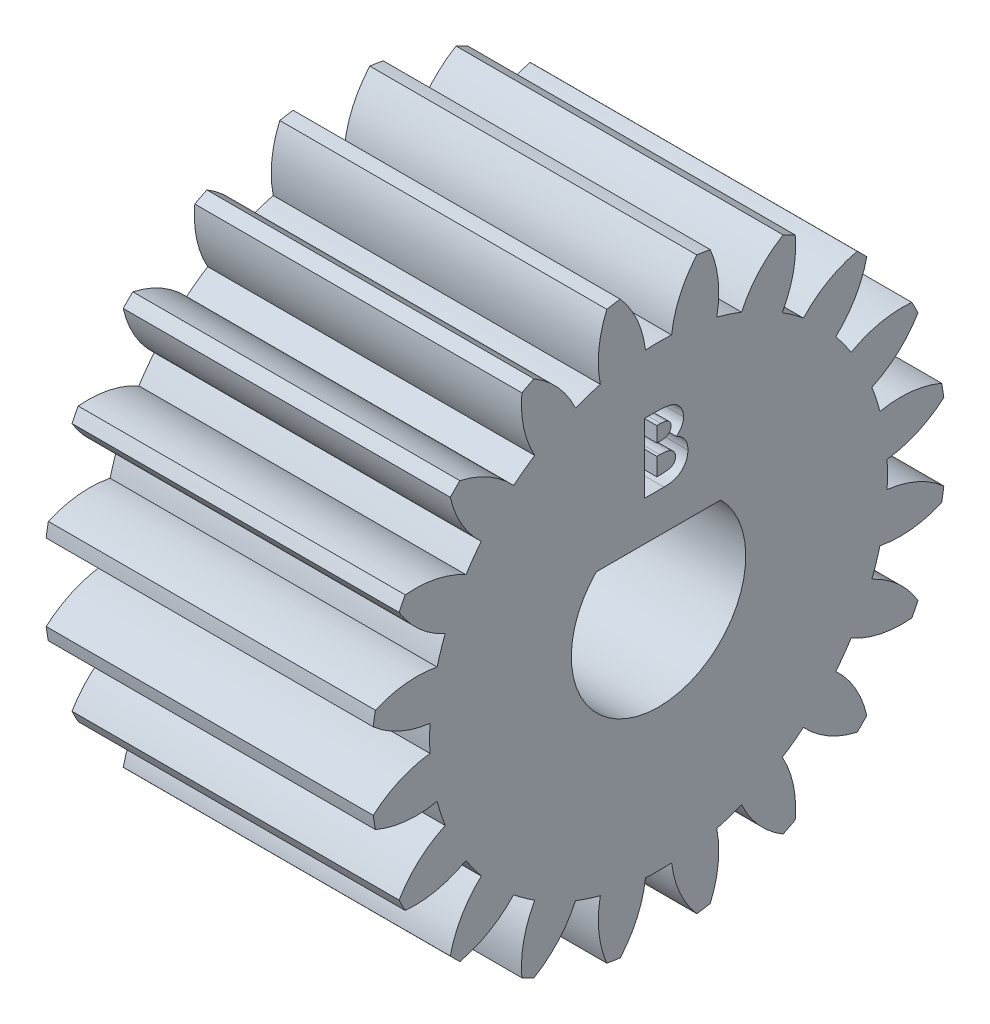
from build123d import *

# Parameters (mm, degrees)
BASPROSKE_W         = 15
BASPROSKE_H         = 13.2
TOOTHCUT_DEPTH      = 24.947442452
TEETHCUTS_COUNT     = 20
TEETHCUTS_ANGLE     = 342
BORSKE_R            = 4
BORE_DEPTH          = 50.0000508
BOSS_EXTRUDE1_START = -15
BOSS_EXTRUDE1_DEPTH = 15
SKETCH2_R           = 7.2
SKETCH2_R_2         = 6
CUT_EXTRUDE1_DEPTH  = 0.5
CUT_EXTRUDE2_DEPTH  = 2


with BuildPart() as part:
    # BasProSke → Base-Revolve (revolve)
    with BuildSketch(Plane(origin=(0, 0, 0), x_dir=(1, 0, 0), z_dir=(0, 1, 0)), mode=Mode.PRIVATE) as base_revolve_sk:
        with Locations((7.5, 6.6)):
            Rectangle(BASPROSKE_W, BASPROSKE_H)
    revolve(base_revolve_sk.sketch.rotate(Axis((-10, 0, 0), (1, 0, 0)), 180), axis=Axis((-10, 0, 0), (1, 0, 0)))

    # TooCutSke → ToothCut (cut, through all)
    with BuildSketch(Plane(origin=(0, 0, 0), x_dir=(0, 0, -1), z_dir=(1, 0, 0))):
        with BuildLine():
            ThreePointArc((0.599012827, 10.48189795), (0, 10.499), (-0.599012827, 10.48189795))
            ThreePointArc((-0.599012827, 10.48189795), (-0.986906343, 11.883983562), (-1.777012823, 13.105473306))
            ThreePointArc((-1.777012823, 13.105473306), (0, 13.2254), (1.777012823, 13.105473306))
            ThreePointArc((1.777012823, 13.105473306), (0.986906343, 11.883983562), (0.599012827, 10.48189795))
        make_face()
    toothcut = extrude(amount=TOOTHCUT_DEPTH, mode=Mode.SUBTRACT)

    # TeethCuts: ToothCut ×20 about axis
    teethcuts_axis = Axis((-10, 0, 0), (1, 0, 0))
    for i in range(1, TEETHCUTS_COUNT):
        add(toothcut.rotate(teethcuts_axis, i * TEETHCUTS_ANGLE / (TEETHCUTS_COUNT - 1)), mode=Mode.SUBTRACT)

    # BorSke → Bore (cut, symmetric)
    with BuildSketch(Plane(origin=(0, 0, 0), x_dir=(0, 0, -1), z_dir=(1, 0, 0))):
        with Locations(Location((0, 0, 0), (0, 0, 180))):
            Circle(BORSKE_R)
    extrude(amount=BORE_DEPTH, both=True, mode=Mode.SUBTRACT)

    # Sketch1 → Boss-Extrude1 (add)
    with BuildSketch(Plane.ZY.offset(BOSS_EXTRUDE1_START)):
        with BuildLine():
            Line((2.856571371, 2.8), (-2.856571371, 2.8))
            ThreePointArc((-2.856571371, 2.8), (0, 4), (2.856571371, 2.8))
        make_face()
    extrude(amount=BOSS_EXTRUDE1_DEPTH)

    # Sketch2 → Cut-Extrude1 (cut)
    with BuildSketch(Plane.ZY):
        Circle(SKETCH2_R)
        Circle(SKETCH2_R_2, mode=Mode.SUBTRACT)
    extrude(amount=-CUT_EXTRUDE1_DEPTH, mode=Mode.SUBTRACT)

    # Sketch3 → Cut-Extrude2 (cut)
    with BuildSketch(Plane(origin=(15, 0, 0), x_dir=(0, 0, -1), z_dir=(1, 0, 0))):
        with BuildLine():
            Line((-0.646125473, 4.61452133), (-0.646125473, 7.78952133))
            Line((-0.646125473, 7.78952133), (-0.137311371, 7.78952133))
            add(Edge.make_bspline(
                [(-0.137311371, 7.78952133), (-0.101691202, 7.789525396), (-0.032766851, 7.789533262), (0.066673, 7.786041261), (0.158895064, 7.781523966), (0.243605854, 7.776470164), (0.320949555, 7.767761453), (0.390808551, 7.758583423), (0.453322423, 7.747515284), (0.491971353, 7.737586821), (0.510154575, 7.732915762)],
                knots=[0, 0, 0, 0, 1.311965854, 2.538629056, 3.664479157, 4.713267157, 5.663616078, 6.530575999, 7.308677837, 8, 8, 8, 8], degree=3))
            add(Edge.make_bspline(
                [(0.510154575, 7.732915762), (0.534030991, 7.726327149), (0.580884184, 7.713398177), (0.647992908, 7.687287558), (0.711654894, 7.658263754), (0.771792412, 7.625153021), (0.828036194, 7.587555622), (0.880172495, 7.545173171), (0.929325765, 7.499706897), (0.973750685, 7.44988967), (1.013903492, 7.397248542), (1.048789083, 7.341797305), (1.07910019, 7.284383846), (1.103357015, 7.224285654), (1.121634077, 7.161779498), (1.135001843, 7.097132289), (1.143665967, 7.030139467), (1.144484613, 6.984562061), (1.144900168, 6.961426379)],
                knots=[0, 0, 0, 0, 1.099996261, 2.158545794, 3.195537121, 4.207578794, 5.205712374, 6.197378256, 7.190519799, 8.17788031, 9.159561366, 10.129234751, 11.085776129, 12.040971148, 13.00380137, 13.975669004, 14.972423361, 16, 16, 16, 16], degree=3))
            add(Edge.make_bspline(
                [(1.144900168, 6.961426379), (1.143813614, 6.9317031), (1.141674867, 6.873196478), (1.128012402, 6.787260835), (1.102393153, 6.706039301), (1.068870989, 6.628034993), (1.023291326, 6.553538869), (0.965413969, 6.482586348), (0.896176342, 6.412992696), (0.84306726, 6.371275996), (0.815443036, 6.34957742)],
                knots=[0, 0, 0, 0, 0.986156485, 1.941127874, 2.875419072, 3.804401753, 4.751181392, 5.761612777, 6.835722519, 8, 8, 8, 8], degree=3))
            add(Edge.make_bspline(
                [(0.815443036, 6.34957742), (0.837828382, 6.338149896), (0.881719851, 6.315743681), (0.944032842, 6.278914554), (1.00172787, 6.239742106), (1.055063621, 6.199014503), (1.102921318, 6.155005242), (1.147277085, 6.110250199), (1.185942638, 6.062185094), (1.220518541, 6.01252306), (1.250571354, 5.960544985), (1.27674404, 5.906338648), (1.298851169, 5.849718869), (1.317572058, 5.790973795), (1.331534102, 5.729901373), (1.340637651, 5.666479758), (1.347607898, 5.600925253), (1.348150117, 5.556271161), (1.348425809, 5.533566803)],
                knots=[0, 0, 0, 0, 1.164658916, 2.283573913, 3.35186032, 4.395461096, 5.390182219, 6.362969632, 7.312859996, 8.245001507, 9.165155236, 10.092416118, 11.032087915, 11.979892451, 12.947605196, 13.931445124, 14.948243989, 16, 16, 16, 16], degree=3))
            add(Edge.make_bspline(
                [(1.348425809, 5.533566803), (1.346636756, 5.490202778), (1.343106067, 5.404624049), (1.317291393, 5.278974819), (1.272536951, 5.159847954), (1.212440964, 5.047716913), (1.138391146, 4.945827706), (1.05325509, 4.856573645), (0.957889921, 4.781022065), (0.869904027, 4.730030609), (0.793803157, 4.695810573), (0.730770228, 4.67465359), (0.663074199, 4.655053792), (0.58947504, 4.641290409), (0.511307004, 4.628692648), (0.427807948, 4.620914529), (0.339133931, 4.61564349), (0.278228782, 4.614902946), (0.246843277, 4.61452133)],
                knots=[0, 0, 0, 0, 1.284142165, 2.534249414, 3.780121997, 5.041676246, 6.291546858, 7.49970053, 8.684500223, 9.883330709, 10.50184324, 11.153274765, 11.851151195, 12.587658647, 13.369265475, 14.195992086, 15.070362669, 16, 16, 16, 16], degree=3))
            Line((0.246843277, 4.61452133), (-0.646125473, 4.61452133))
        make_face()
        with BuildLine():
            Line((-0.076253678, 7.219649536), (-0.076253678, 6.527662356))
            Line((-0.076253678, 6.527662356), (0.075118517, 6.527662356))
            add(Edge.make_bspline(
                [(0.075118517, 6.527662356), (0.095691359, 6.527841759), (0.135405984, 6.528188086), (0.192769547, 6.532648651), (0.246108398, 6.540258654), (0.295220232, 6.550876521), (0.340562544, 6.564359665), (0.381845676, 6.580582791), (0.418888111, 6.600376768), (0.461922854, 6.62986077), (0.507413681, 6.673247798), (0.547458744, 6.735929351), (0.571045018, 6.808012898), (0.573671893, 6.858851797), (0.575028373, 6.885104263)],
                knots=[0, 0, 0, 0, 1.065314748, 2.056525647, 2.977365736, 3.853934255, 4.656397591, 5.425096493, 6.14721249, 6.826394842, 8.123232004, 9.372140726, 10.643011755, 12, 12, 12, 12], degree=3))
            add(Edge.make_bspline(
                [(0.575028373, 6.885104263), (0.573942941, 6.90969406), (0.571844301, 6.957237444), (0.548095955, 7.023992589), (0.511210079, 7.08315131), (0.467661117, 7.123640617), (0.426651307, 7.15129362), (0.391536192, 7.169501944), (0.352994716, 7.18580185), (0.310280757, 7.198265156), (0.263638237, 7.207617182), (0.213293723, 7.214485124), (0.159160354, 7.219159738), (0.121770321, 7.219482768), (0.102467275, 7.219649536)],
                knots=[0, 0, 0, 0, 1.347982417, 2.606269829, 3.849316587, 5.153353503, 5.842674298, 6.568177932, 7.326619318, 8.142485038, 9.012069166, 9.942760135, 10.937925643, 12, 12, 12, 12], degree=3))
            Line((0.102467275, 7.219649536), (-0.076253678, 7.219649536))
        make_face(mode=Mode.SUBTRACT)
        with BuildLine():
            Line((-0.076253678, 5.998495689), (-0.076253678, 5.184393125))
            Line((-0.076253678, 5.184393125), (0.08783887, 5.184393125))
            add(Edge.make_bspline(
                [(0.08783887, 5.184393125), (0.120280175, 5.184578461), (0.182652634, 5.184934793), (0.27200107, 5.189240125), (0.353241135, 5.196999728), (0.426157575, 5.206686967), (0.490862073, 5.219811661), (0.547135915, 5.236498028), (0.595750821, 5.254855937), (0.636415296, 5.277530135), (0.669635842, 5.303917278), (0.699613902, 5.330885572), (0.724056144, 5.361996048), (0.743395302, 5.395913218), (0.760133309, 5.431794555), (0.770228493, 5.471041214), (0.777914611, 5.512490016), (0.778337599, 5.541159256), (0.778554014, 5.55582742)],
                knots=[0, 0, 0, 0, 1.753078804, 3.370512758, 4.83203934, 6.162291463, 7.344201807, 8.395507345, 9.331626367, 10.147333109, 10.898971645, 11.62040215, 12.321813352, 13.025280112, 13.727906689, 14.453419512, 15.208716525, 16, 16, 16, 16], degree=3))
            add(Edge.make_bspline(
                [(0.778554014, 5.55582742), (0.778076757, 5.572600696), (0.777147188, 5.605270526), (0.769555391, 5.653020969), (0.755758616, 5.697599175), (0.738380905, 5.74014507), (0.714198897, 5.779135363), (0.685459406, 5.815919359), (0.650734764, 5.849251439), (0.611684879, 5.881147652), (0.566137054, 5.909074515), (0.514069919, 5.933306015), (0.455200619, 5.953543271), (0.389346797, 5.969656188), (0.316797154, 5.983330998), (0.237022155, 5.991496369), (0.150686195, 5.997569314), (0.090819436, 5.998179881), (0.059854094, 5.998495689)],
                knots=[0, 0, 0, 0, 0.845221588, 1.646264278, 2.427170338, 3.19324141, 3.95557735, 4.731569926, 5.540061037, 6.376114724, 7.268642756, 8.224665384, 9.265483498, 10.400594375, 11.639216012, 12.983232105, 14.439614077, 16, 16, 16, 16], degree=3))
            Line((0.059854094, 5.998495689), (-0.076253678, 5.998495689))
        make_face(mode=Mode.SUBTRACT)
    extrude(amount=-CUT_EXTRUDE2_DEPTH, mode=Mode.SUBTRACT)


solid = part.part
